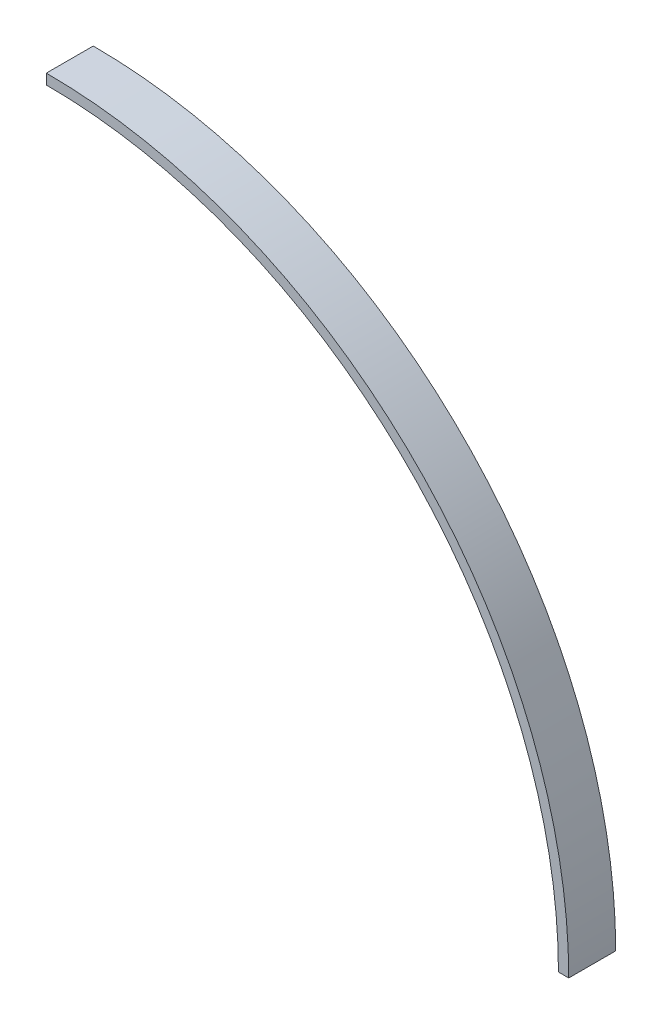
from build123d import *

# Parameters (mm, degrees)
SKETCH1_R                       = 252.5
SKETCH1_R_2                     = 248.75
BOSS_EXTRUDE1_DEPTH             = 21.8
SKETCH2_R                       = 253.75
SKETCH2_R_2                     = 250.5
BOSS_EXTRUDE2_DEPTH             = 1
BOSS_EXTRUDE2_DIRECTION_2_REACH = 359.754


with BuildPart() as part:
    # Sketch1 → Boss-Extrude1 (new body)
    with BuildSketch(Plane.XY):
        Circle(SKETCH1_R)
        Circle(SKETCH1_R_2, mode=Mode.SUBTRACT)
    extrude(amount=BOSS_EXTRUDE1_DEPTH)

    # Sketch2 → Boss-Extrude2 (add)
    with BuildSketch(Plane(origin=(0, 0, 0), x_dir=(-1, 0, 0), z_dir=(0, 0, -1))):
        Circle(SKETCH2_R)
        Circle(SKETCH2_R_2, mode=Mode.SUBTRACT)
    extrude(amount=BOSS_EXTRUDE2_DEPTH)

    # Boss-Extrude2 direction 2: up to this face of the body (flat: up to its plane)
    boss_extrude2_direction_2_end = Plane(part.part.faces().sort_by_distance((-251.785822151, 0, 21.8))[0])
    # Sketch2 → Boss-Extrude2 direction 2 (add, up to the picked face)
    with BuildSketch(Plane(origin=(0, 0, 0), x_dir=(-1, 0, 0), z_dir=(0, 0, -1)), mode=Mode.PRIVATE) as boss_extrude2_direction_2_sk1:
        Circle(SKETCH2_R)
        Circle(SKETCH2_R_2, mode=Mode.SUBTRACT)
    boss_extrude2_direction_2_tool1 = split(extrude(boss_extrude2_direction_2_sk1.sketch, amount=-BOSS_EXTRUDE2_DIRECTION_2_REACH, mode=Mode.PRIVATE), bisect_by=boss_extrude2_direction_2_end, keep=Keep.BOTH, mode=Mode.PRIVATE)
    add(boss_extrude2_direction_2_tool1.solids().sort_by(Axis((253.032287, 0, 0), (0, 0, 1)))[0])

    # SurfaceCut1
    split(bisect_by=Plane(origin=(0, 0, 0), x_dir=(1, 0, 0), z_dir=(0, 1, 0)), keep=Keep.TOP)

    # SurfaceCut2
    split(bisect_by=Plane(origin=(0, 0, 0), x_dir=(0, 0, -1), z_dir=(1, 0, 0)), keep=Keep.TOP)


solid = part.part
